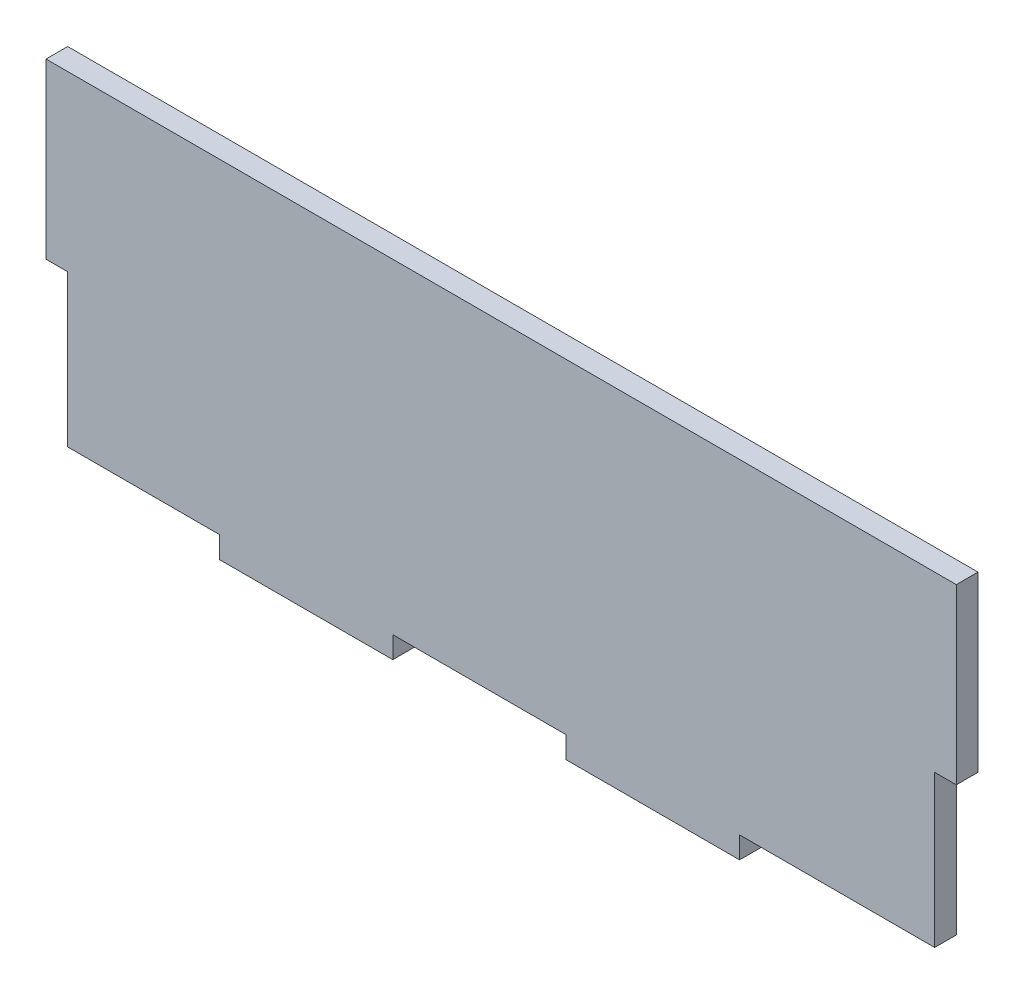
from build123d import *

# Parameters (mm, degrees)
BOSS_EXTRUDE1_DEPTH = 6.35


with BuildPart() as part:
    # Sketch1 → Boss-Extrude1 (new body)
    with BuildSketch(Plane.XY):
        Polygon((0, 101.6), (0, 50.8), (6.35, 50.8), (6.35, 6.35), (50.8, 6.35), (50.8, 0), (101.6, 0), (101.6, 6.35), (152.4, 6.35), (152.4, 0), (203.2, 0), (203.2, 6.35), (254, 6.35), (260.35, 6.35), (260.35, 50.8), (266.7, 50.8), (266.7, 101.6), align=None)
    extrude(amount=BOSS_EXTRUDE1_DEPTH)


solid = part.part
